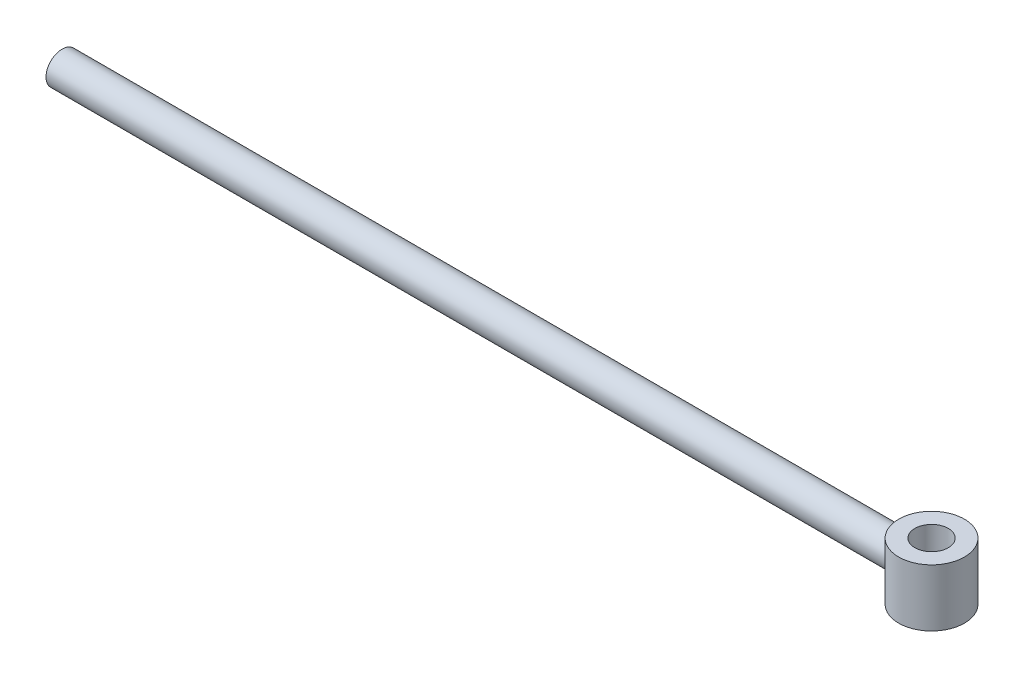
from build123d import *

# Parameters (mm, degrees)
SKETCH2_W                       = 22.606
SKETCH2_H                       = 6.35
SKETCH3_R                       = 6.35
BOSS_EXTRUDE1_DEPTH             = 304.8
BOSS_EXTRUDE1_DIRECTION_2_REACH = 174.122


with BuildPart() as part:
    # Sketch2 → Revolve1 (revolve)
    with BuildSketch(Plane(origin=(38.1, 0, 0), x_dir=(0, -1, 0), z_dir=(-1, 0, 0))):
        with Locations((-49.657, -129.921)):
            Rectangle(SKETCH2_W, SKETCH2_H)
    revolve(axis=Axis((38.1, 50.8, -139.7), (0, -1, 0)))

    # Sketch3 → Boss-Extrude1 (add)
    with BuildSketch(Plane.ZY):
        with Locations((-139.7, 50.165)):
            Circle(SKETCH3_R)
    extrude(amount=BOSS_EXTRUDE1_DEPTH)

    # Sketch3 → Boss-Extrude1 direction 2 (add, up to next)
    with BuildSketch(Plane.ZY, mode=Mode.PRIVATE) as boss_extrude1_direction_2_sk1:
        with Locations((-139.7, 50.165)):
            Circle(SKETCH3_R)
    boss_extrude1_direction_2_tool1 = extrude(boss_extrude1_direction_2_sk1.sketch, amount=-BOSS_EXTRUDE1_DIRECTION_2_REACH, mode=Mode.PRIVATE) - part.part
    add(boss_extrude1_direction_2_tool1.solids().sort_by_distance((0, 50.165, -139.7))[0])


solid = part.part
